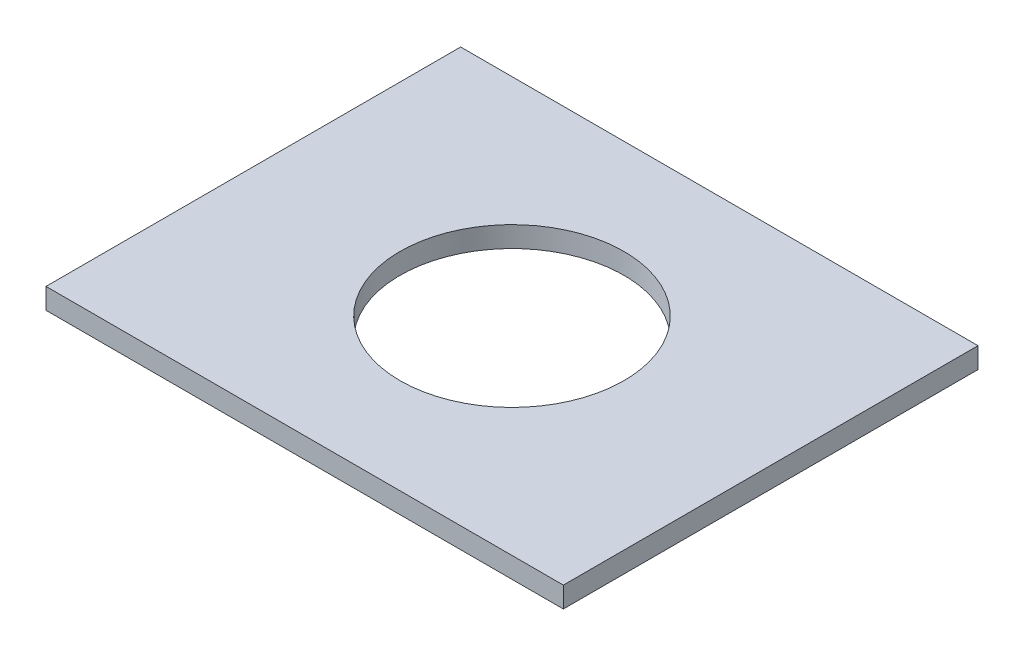
from build123d import *

# Parameters (mm, degrees)
SKETCH1_W           = 124.76
SKETCH1_H           = 100
BOSS_EXTRUDE1_DEPTH = 5
SKETCH2_R           = 27
CUT_EXTRUDE1_DEPTH  = 5


with BuildPart() as part:
    # Sketch1 → Boss-Extrude1 (new body)
    with BuildSketch(Plane(origin=(0, 0, 0), x_dir=(1, 0, 0), z_dir=(0, 1, 0))):
        Rectangle(SKETCH1_W, SKETCH1_H)
    extrude(amount=BOSS_EXTRUDE1_DEPTH)

    # Sketch2 → Cut-Extrude1 (cut)
    with BuildSketch(Plane(origin=(0, 5, 0), x_dir=(1, 0, 0), z_dir=(0, 1, 0))):
        with Locations(Location((0, 0, 0), (0, 0, 270))):
            Circle(SKETCH2_R)
    extrude(amount=-CUT_EXTRUDE1_DEPTH, mode=Mode.SUBTRACT)


solid = part.part
